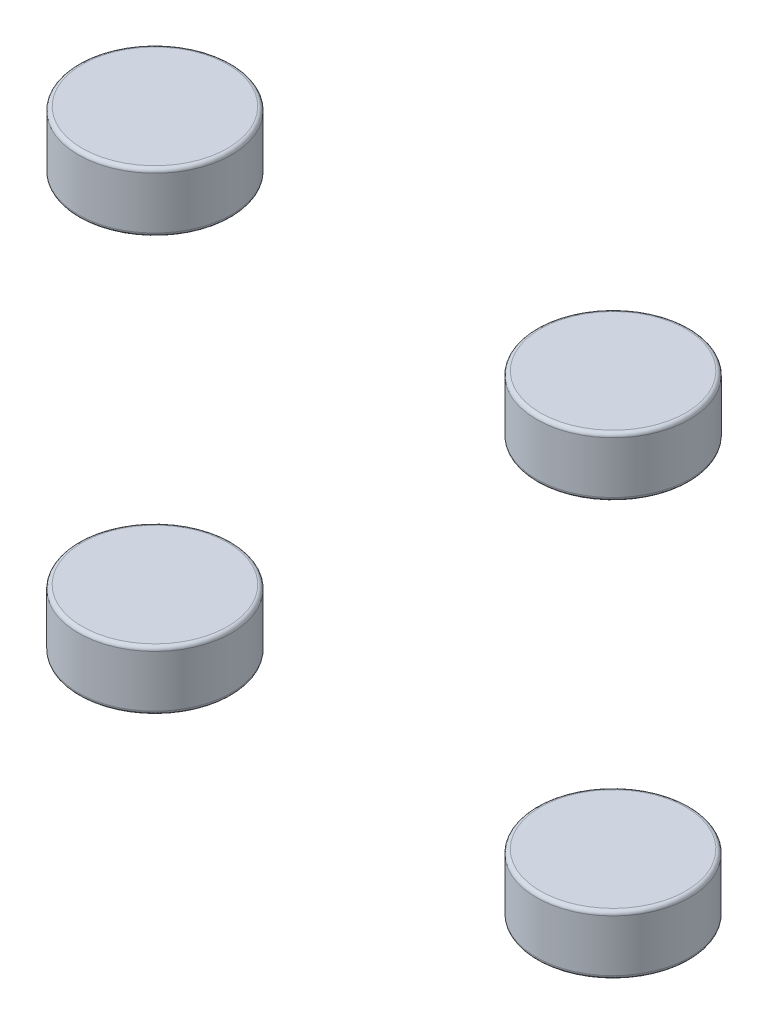
from build123d import *

# Parameters (mm, degrees)
F_3D_SKETCH_1_R      = 259
LEFT_WHEELS_DEPTH    = 201
LEFT_WHEELS_2_DEPTH  = 201
FILLET1_R            = 13
FILLET2_R            = 13
F_3DSKETCH3_R        = 259
RIGHT_WHEELS_DEPTH   = 201
RIGHT_WHEELS_2_DEPTH = 201
FILLET4_R            = 13
FILLET3_R            = 13


with BuildPart() as part:
    # 3D Sketch 1 → Left Wheels (new body)
    with BuildSketch(Plane(origin=(-420, -600, 235), x_dir=(1, 0, 0), z_dir=(0, -1, 0))):
        with Locations(Location((0, 0, 0), (0, 0, 90))):
            Circle(F_3D_SKETCH_1_R)
    extrude(amount=LEFT_WHEELS_DEPTH)

    # Fillet2
    fillet2_edges = [part.edges().sort_by_distance(p)[0] for p in [
        (-420, -801, -24),
        (-420, -600, -24),
    ]]
    fillet(fillet2_edges, radius=FILLET2_R)


with BuildPart() as body_2:
    # 3D Sketch 1 → Left Wheels 2 (new body)
    with BuildSketch(Plane(origin=(-420, -600, 235), x_dir=(1, 0, 0), z_dir=(0, -1, 0))):
        with Locations(Location((1550, 0, 0), (0, 0, 90))):
            Circle(F_3D_SKETCH_1_R)
    extrude(amount=LEFT_WHEELS_2_DEPTH)

    # Fillet1
    fillet1_edges = [body_2.edges().sort_by_distance(p)[0] for p in [
        (1130, -801, -24),
        (1130, -600, -24),
    ]]
    fillet(fillet1_edges, radius=FILLET1_R)


with BuildPart() as body_3:
    # 3DSketch3 → Right Wheels (new body)
    with BuildSketch(Plane(origin=(1130, 600, 235), x_dir=(-1, 0, 0), z_dir=(0, 1, 0))):
        with Locations(Location((0, 0, 0), (0, 0, 90))):
            Circle(F_3DSKETCH3_R)
    extrude(amount=RIGHT_WHEELS_DEPTH)

    # Fillet3
    fillet3_edges = [body_3.edges().sort_by_distance(p)[0] for p in [
        (1130, 801, -24),
        (1130, 600, -24),
    ]]
    fillet(fillet3_edges, radius=FILLET3_R)


with BuildPart() as body_4:
    # 3DSketch3 → Right Wheels 2 (new body)
    with BuildSketch(Plane(origin=(1130, 600, 235), x_dir=(-1, 0, 0), z_dir=(0, 1, 0))):
        with Locations(Location((1550, 0, 0), (0, 0, 90))):
            Circle(F_3DSKETCH3_R)
    extrude(amount=RIGHT_WHEELS_2_DEPTH)

    # Fillet4
    fillet4_edges = [body_4.edges().sort_by_distance(p)[0] for p in [
        (-420, 801, -24),
        (-420, 600, -24),
    ]]
    fillet(fillet4_edges, radius=FILLET4_R)


solid = Compound([part.part, body_2.part, body_3.part, body_4.part])
